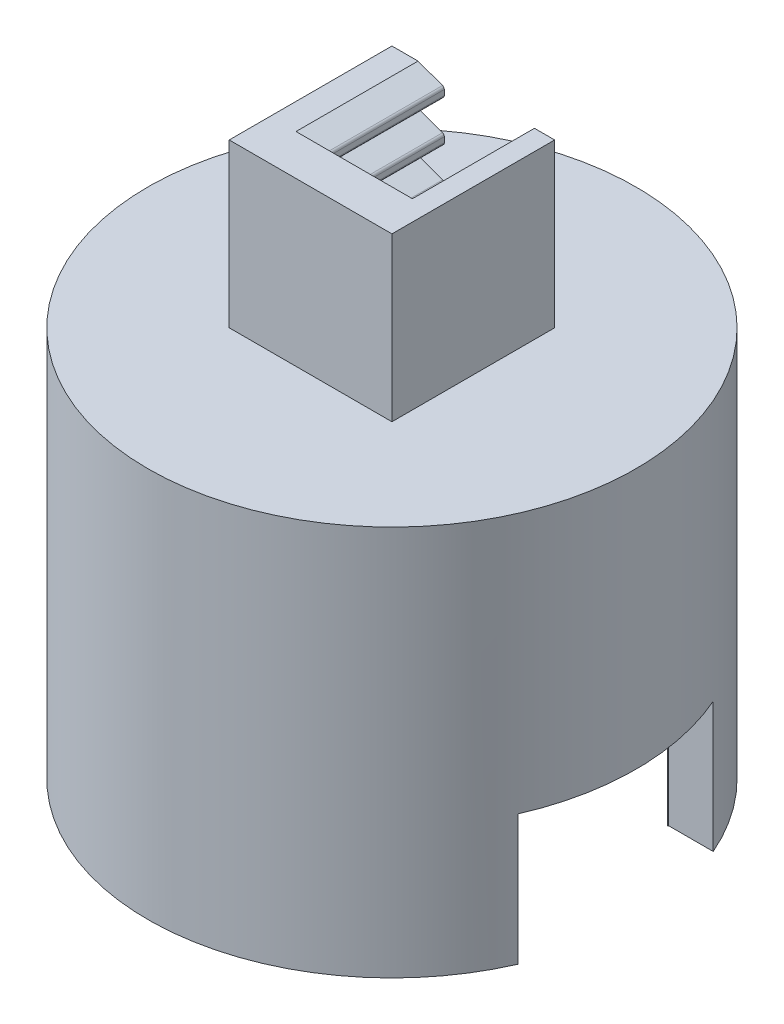
from build123d import *

# Parameters (mm, degrees)
SKETCH1_R           = 15
SKETCH1_R_2         = 12.5
BOSS_EXTRUDE1_DEPTH = 20
SKETCH2_R           = 15
BOSS_EXTRUDE2_DEPTH = 4
SKETCH3_W           = 12
SKETCH3_H           = 8
CUT_EXTRUDE1_DEPTH  = 4
SKETCH4_W           = 10
SKETCH4_H           = 10
BOSS_EXTRUDE3_DEPTH = 10
CUT_EXTRUDE2_DEPTH  = 7.5


with BuildPart() as part:
    # Sketch1 → Boss-Extrude1 (new body)
    with BuildSketch(Plane(origin=(0, 0, 0), x_dir=(1, 0, 0), z_dir=(0, 1, 0))):
        with Locations(Location((0, 0, 0), (0, 0, 270))):
            Circle(SKETCH1_R)
        with Locations(Location((0, 0, 0), (0, 0, 270))):
            Circle(SKETCH1_R_2, mode=Mode.SUBTRACT)
    extrude(amount=BOSS_EXTRUDE1_DEPTH)

    # Sketch2 → Boss-Extrude2 (add)
    with BuildSketch(Plane(origin=(0, 20, 0), x_dir=(1, 0, 0), z_dir=(0, 1, 0))):
        with Locations(Location((0, 0, 0), (0, 0, 270))):
            Circle(SKETCH2_R)
    extrude(amount=BOSS_EXTRUDE2_DEPTH)

    # Sketch3 → Cut-Extrude1 (cut)
    with BuildSketch(Plane(origin=(15, 0, 0), x_dir=(0, 0, -1), z_dir=(1, 0, 0))):
        with Locations((0, 4)):
            Rectangle(SKETCH3_W, SKETCH3_H)
    extrude(amount=-CUT_EXTRUDE1_DEPTH, mode=Mode.SUBTRACT)

    # Sketch4 → Boss-Extrude3 (add)
    with BuildSketch(Plane(origin=(0, 24, 0), x_dir=(1, 0, 0), z_dir=(0, 1, 0))):
        Rectangle(SKETCH4_W, SKETCH4_H)
    extrude(amount=BOSS_EXTRUDE3_DEPTH)

    # Sketch6 → Cut-Extrude2 (cut)
    with BuildSketch(Plane(origin=(0, 0, -5), x_dir=(-1, 0, 0), z_dir=(0, 0, -1))):
        with BuildLine():
            Line((-1.758355149, 34), (-3.758355149, 34))
            Line((-3.758355149, 34), (-3.758355149, 24))
            Line((-3.758355149, 24), (3.541644851, 24))
            Line((3.541644851, 24), (3.541644851, 24.674283625))
            Line((3.541644851, 24.674283625), (1.891753796, 25.274794859))
            ThreePointArc((1.891753796, 25.274794859), (1.811908661, 25.336062186), (1.781644851, 25.432046729))
            Line((1.781644851, 25.432046729), (1.781644851, 25.755508896))
            ThreePointArc((1.781644851, 25.755508896), (1.811908661, 25.85149344), (1.891753796, 25.912760766))
            Line((1.891753796, 25.912760766), (3.541644851, 26.513272))
            Line((3.541644851, 26.513272), (3.541644851, 27.187555625))
            Line((3.541644851, 27.187555625), (1.891753796, 27.788066859))
            ThreePointArc((1.891753796, 27.788066859), (1.811908661, 27.849334186), (1.781644851, 27.945318729))
            Line((1.781644851, 27.945318729), (1.781644851, 28.268780896))
            ThreePointArc((1.781644851, 28.268780896), (1.811908661, 28.36476544), (1.891753796, 28.426032766))
            Line((1.891753796, 28.426032766), (3.541644851, 29.026544))
            Line((3.541644851, 29.026544), (3.541644851, 29.700827625))
            Line((3.541644851, 29.700827625), (1.891753796, 30.301338859))
            ThreePointArc((1.891753796, 30.301338859), (1.811908661, 30.362606186), (1.781644851, 30.458590729))
            Line((1.781644851, 30.458590729), (1.781644851, 30.782052896))
            ThreePointArc((1.781644851, 30.782052896), (1.811908661, 30.87803744), (1.891753796, 30.939304766))
            Line((1.891753796, 30.939304766), (3.541644851, 31.539816))
            Line((3.541644851, 31.539816), (3.541644851, 32.214099625))
            Line((3.541644851, 32.214099625), (1.891753796, 32.814610859))
            ThreePointArc((1.891753796, 32.814610859), (1.811908661, 32.875878186), (1.781644851, 32.971862729))
            Line((1.781644851, 32.971862729), (1.781644851, 33.295324896))
            ThreePointArc((1.781644851, 33.295324896), (1.811908661, 33.39130944), (1.891753796, 33.452576766))
            Line((1.891753796, 33.452576766), (3.39578677, 34))
            Line((3.39578677, 34), (0.241644851, 34))
            Line((0.241644851, 34), (-1.758355149, 34))
        make_face()
    extrude(amount=-CUT_EXTRUDE2_DEPTH, mode=Mode.SUBTRACT)


solid = part.part
